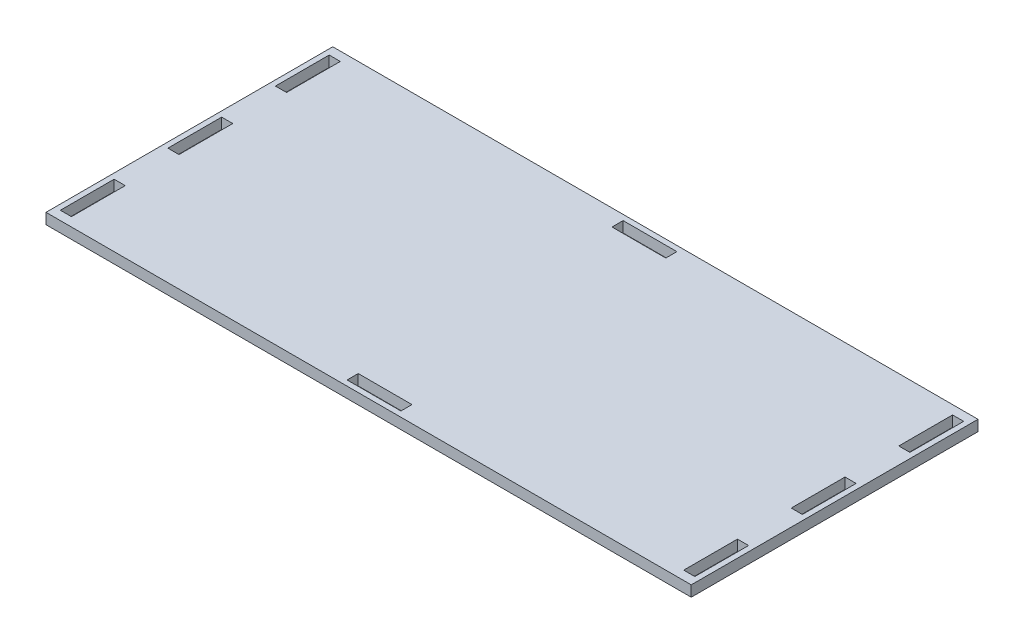
from build123d import *

# Parameters (mm, degrees)
SKETCH_1_W      = 180
SKETCH_1_H      = 80
SKETCH_1_W_2    = 15
SKETCH_1_H_2    = 3.1
SKETCH_1_W_3    = 3.1
SKETCH_1_H_3    = 15
EXTRUDE_1_DEPTH = 3


with BuildPart() as part:
    # 草图1 → 凸台-拉伸1 (new body)
    with BuildSketch(Plane(origin=(0, 0, 0), x_dir=(1, 0, 0), z_dir=(0, 1, 0))):
        Rectangle(SKETCH_1_W, SKETCH_1_H)
        with Locations((0, 36.95)):
            Rectangle(SKETCH_1_W_2, SKETCH_1_H_2, mode=Mode.SUBTRACT)
        with Locations((86.95, 0)):
            Rectangle(SKETCH_1_W_3, SKETCH_1_H_3, mode=Mode.SUBTRACT)
        with Locations((86.95, -30)):
            Rectangle(SKETCH_1_W_3, SKETCH_1_H_3, mode=Mode.SUBTRACT)
        with Locations((-86.95, 30)):
            Rectangle(SKETCH_1_W_3, SKETCH_1_H_3, mode=Mode.SUBTRACT)
        with Locations((-86.95, 0)):
            Rectangle(SKETCH_1_W_3, SKETCH_1_H_3, mode=Mode.SUBTRACT)
        with Locations((-86.95, -30)):
            Rectangle(SKETCH_1_W_3, SKETCH_1_H_3, mode=Mode.SUBTRACT)
        with Locations((86.95, 30)):
            Rectangle(SKETCH_1_W_3, SKETCH_1_H_3, mode=Mode.SUBTRACT)
        with Locations((0, -36.95)):
            Rectangle(SKETCH_1_W_2, SKETCH_1_H_2, mode=Mode.SUBTRACT)
    extrude(amount=EXTRUDE_1_DEPTH)


solid = part.part
